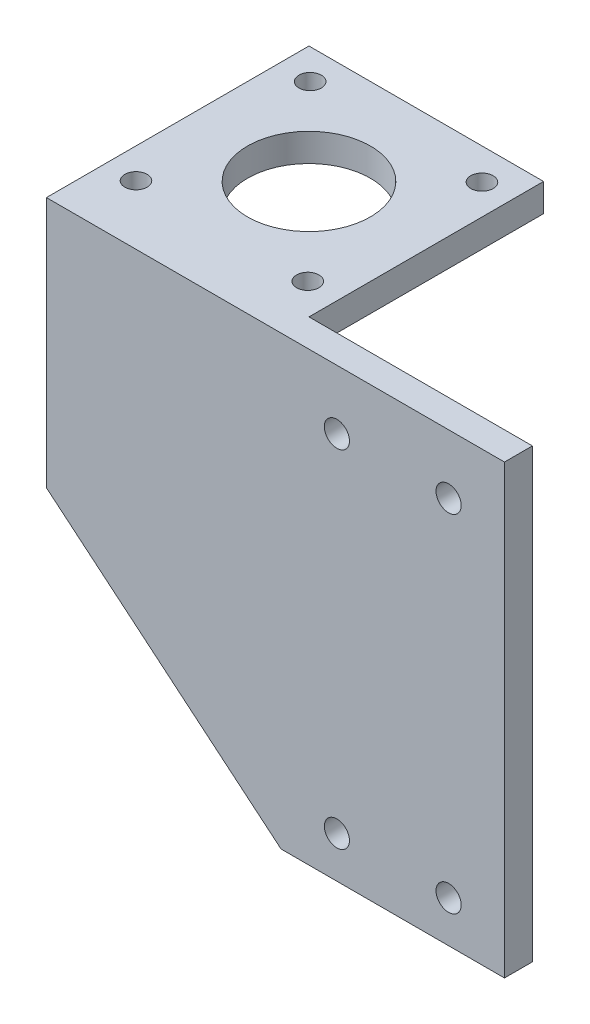
from build123d import *

# Parameters (mm, degrees)
SKETCH1_W           = 42
SKETCH1_H           = 42
SKETCH1_R           = 11
SKETCH1_R_2         = 2
BOSS_EXTRUDE1_DEPTH = 5
SKETCH2_R           = 2.25
BOSS_EXTRUDE2_DEPTH = 5


with BuildPart() as part:
    # Sketch1 → Boss-Extrude1 (new body)
    with BuildSketch(Plane(origin=(0, 0, 0), x_dir=(1, 0, 0), z_dir=(0, 1, 0))):
        Rectangle(SKETCH1_W, SKETCH1_H)
        with Locations(Location((0, 0, 0), (0, 0, 270))):
            Circle(SKETCH1_R, mode=Mode.SUBTRACT)
        with Locations(Location((-15.592519129, -15.378015061, 0), (0, 0, 270))):
            Circle(SKETCH1_R_2, mode=Mode.SUBTRACT)
        with Locations(Location((-15.378015061, 15.592519129, 0), (0, 0, 270))):
            Circle(SKETCH1_R_2, mode=Mode.SUBTRACT)
        with Locations(Location((15.592519129, 15.378015061, 0), (0, 0, 270))):
            Circle(SKETCH1_R_2, mode=Mode.SUBTRACT)
        with Locations(Location((15.378015061, -15.592519129, 0), (0, 0, 270))):
            Circle(SKETCH1_R_2, mode=Mode.SUBTRACT)
    extrude(amount=BOSS_EXTRUDE1_DEPTH)

    # Sketch2 → Boss-Extrude2 (add)
    with BuildSketch(Plane.XY.offset(21)):
        Polygon((21, 5), (61, 5), (61, -75), (21, -75), (-21, -40), (-21, 0), (-21, 5), align=None)
        with Locations((51, -67.581845608)):
            Circle(SKETCH2_R, mode=Mode.SUBTRACT)
        with Locations((31, -67.581845608)):
            Circle(SKETCH2_R, mode=Mode.SUBTRACT)
        with Locations((31, -5.627348656)):
            Circle(SKETCH2_R, mode=Mode.SUBTRACT)
        with Locations((51, -5.627348656)):
            Circle(SKETCH2_R, mode=Mode.SUBTRACT)
    extrude(amount=BOSS_EXTRUDE2_DEPTH)


solid = part.part
